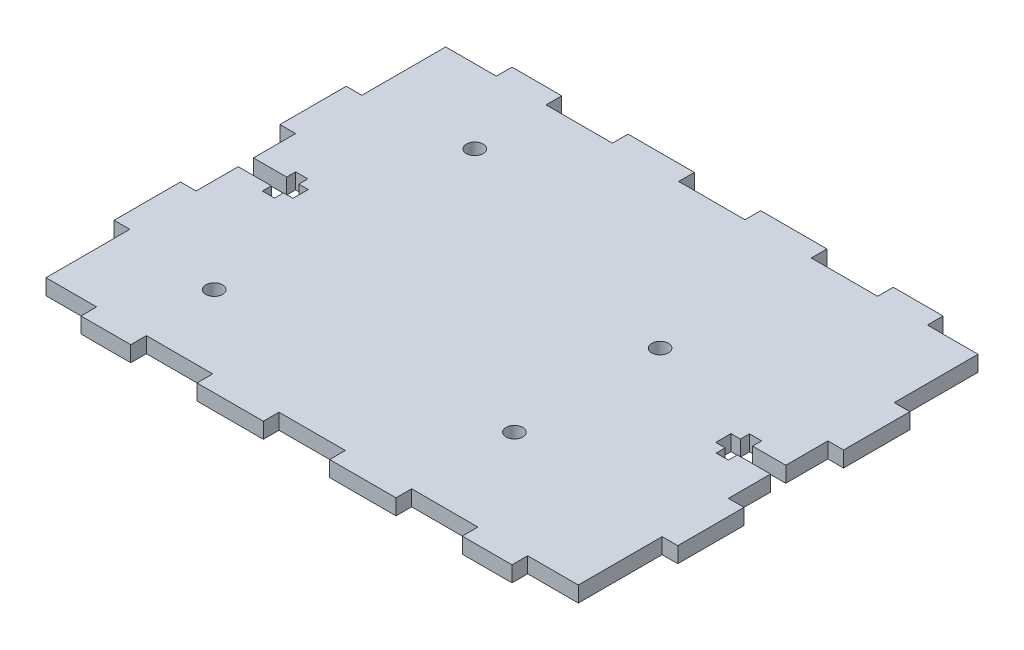
from build123d import *

# Parameters (mm, degrees)
SKETCH1_W           = 107.95
SKETCH1_H           = 82.55
BOSS_EXTRUDE1_DEPTH = 3
CUT_EXTRUDE2_REACH  = 137.929
SKETCH3_W           = 12.7
SKETCH3_H           = 3
SKETCH3_W_2         = 3
SKETCH3_H_2         = 19.05
CUT_EXTRUDE3_REACH  = 137.929
SKETCH4_R           = 1.6
CUT_EXTRUDE5_REACH  = 137.929


with BuildPart() as part:
    # Sketch1 → Boss-Extrude1 (new body)
    with BuildSketch(Plane(origin=(0, 0, 0), x_dir=(1, 0, 0), z_dir=(0, 1, 0))):
        with Locations((53.975, 41.275)):
            Rectangle(SKETCH1_W, SKETCH1_H)
    extrude(amount=BOSS_EXTRUDE1_DEPTH)

    # Sketch3 → Cut-Extrude2 (cut, up to next)
    with BuildSketch(Plane(origin=(0, 3, 0), x_dir=(1, 0, 0), z_dir=(0, 1, 0)), mode=Mode.PRIVATE) as cut_extrude2_sk1:
        with Locations((28.575, 1.5)):
            Rectangle(SKETCH3_W, SKETCH3_H)
    cut_extrude2_tool1 = extrude(cut_extrude2_sk1.sketch, amount=-CUT_EXTRUDE2_REACH, mode=Mode.PRIVATE) & part.part
    # Sketch3 → Cut-Extrude2 (cut, up to next)
    with BuildSketch(Plane(origin=(0, 3, 0), x_dir=(1, 0, 0), z_dir=(0, 1, 0)), mode=Mode.PRIVATE) as cut_extrude2_sk2:
        with Locations((79.375, 1.5)):
            Rectangle(SKETCH3_W, SKETCH3_H)
    cut_extrude2_tool2 = extrude(cut_extrude2_sk2.sketch, amount=-CUT_EXTRUDE2_REACH, mode=Mode.PRIVATE) & part.part
    # Sketch3 → Cut-Extrude2 (cut, up to next)
    with BuildSketch(Plane(origin=(0, 3, 0), x_dir=(1, 0, 0), z_dir=(0, 1, 0)), mode=Mode.PRIVATE) as cut_extrude2_sk3:
        with Locations((79.375, 81.05)):
            Rectangle(SKETCH3_W, SKETCH3_H)
    cut_extrude2_tool3 = extrude(cut_extrude2_sk3.sketch, amount=-CUT_EXTRUDE2_REACH, mode=Mode.PRIVATE) & part.part
    # Sketch3 → Cut-Extrude2 (cut, up to next)
    with BuildSketch(Plane(origin=(0, 3, 0), x_dir=(1, 0, 0), z_dir=(0, 1, 0)), mode=Mode.PRIVATE) as cut_extrude2_sk4:
        with Locations((1.5, 41.275)):
            Rectangle(SKETCH3_W_2, SKETCH3_H_2)
    cut_extrude2_tool4 = extrude(cut_extrude2_sk4.sketch, amount=-CUT_EXTRUDE2_REACH, mode=Mode.PRIVATE) & part.part
    # Sketch3 → Cut-Extrude2 (cut, up to next)
    with BuildSketch(Plane(origin=(0, 3, 0), x_dir=(1, 0, 0), z_dir=(0, 1, 0)), mode=Mode.PRIVATE) as cut_extrude2_sk5:
        with Locations((28.575, 81.05)):
            Rectangle(SKETCH3_W, SKETCH3_H)
    cut_extrude2_tool5 = extrude(cut_extrude2_sk5.sketch, amount=-CUT_EXTRUDE2_REACH, mode=Mode.PRIVATE) & part.part
    # Sketch3 → Cut-Extrude2 (cut, up to next)
    with BuildSketch(Plane(origin=(0, 3, 0), x_dir=(1, 0, 0), z_dir=(0, 1, 0)), mode=Mode.PRIVATE) as cut_extrude2_sk6:
        Polygon((53.975, 3), (60.325, 3), (60.325, 0), (53.975, 0), (47.625, 0), (47.625, 3), align=None)
    cut_extrude2_tool6 = extrude(cut_extrude2_sk6.sketch, amount=-CUT_EXTRUDE2_REACH, mode=Mode.PRIVATE) & part.part
    # Sketch3 → Cut-Extrude2 (cut, up to next)
    with BuildSketch(Plane(origin=(0, 3, 0), x_dir=(1, 0, 0), z_dir=(0, 1, 0)), mode=Mode.PRIVATE) as cut_extrude2_sk7:
        Polygon((60.325, 82.55), (53.975, 82.55), (47.625, 82.55), (47.625, 79.55), (53.975, 79.55), (60.325, 79.55), align=None)
    cut_extrude2_tool7 = extrude(cut_extrude2_sk7.sketch, amount=-CUT_EXTRUDE2_REACH, mode=Mode.PRIVATE) & part.part
    # Sketch3 → Cut-Extrude2 (cut, up to next)
    with BuildSketch(Plane(origin=(0, 3, 0), x_dir=(1, 0, 0), z_dir=(0, 1, 0)), mode=Mode.PRIVATE) as cut_extrude2_sk8:
        Polygon((0, 19.05), (3, 19.05), (3, 3), (12.7, 3), (12.7, 0), (0, 0), (0, 3), align=None)
    cut_extrude2_tool8 = extrude(cut_extrude2_sk8.sketch, amount=-CUT_EXTRUDE2_REACH, mode=Mode.PRIVATE) & part.part
    # Sketch3 → Cut-Extrude2 (cut, up to next)
    with BuildSketch(Plane(origin=(0, 3, 0), x_dir=(1, 0, 0), z_dir=(0, 1, 0)), mode=Mode.PRIVATE) as cut_extrude2_sk9:
        Polygon((107.95, 0), (107.95, 3), (107.95, 19.05), (104.95, 19.05), (104.95, 3), (95.25, 3), (95.25, 0), align=None)
    cut_extrude2_tool9 = extrude(cut_extrude2_sk9.sketch, amount=-CUT_EXTRUDE2_REACH, mode=Mode.PRIVATE) & part.part
    # Sketch3 → Cut-Extrude2 (cut, up to next)
    with BuildSketch(Plane(origin=(0, 3, 0), x_dir=(1, 0, 0), z_dir=(0, 1, 0)), mode=Mode.PRIVATE) as cut_extrude2_sk10:
        Polygon((0, 79.55), (0, 63.5), (3, 63.5), (3, 79.55), (12.7, 79.55), (12.7, 82.55), (0, 82.55), align=None)
    cut_extrude2_tool10 = extrude(cut_extrude2_sk10.sketch, amount=-CUT_EXTRUDE2_REACH, mode=Mode.PRIVATE) & part.part
    # Sketch3 → Cut-Extrude2 (cut, up to next)
    with BuildSketch(Plane(origin=(0, 3, 0), x_dir=(1, 0, 0), z_dir=(0, 1, 0)), mode=Mode.PRIVATE) as cut_extrude2_sk11:
        with Locations((106.45, 41.275)):
            Rectangle(SKETCH3_W_2, SKETCH3_H_2)
    cut_extrude2_tool11 = extrude(cut_extrude2_sk11.sketch, amount=-CUT_EXTRUDE2_REACH, mode=Mode.PRIVATE) & part.part
    # Sketch3 → Cut-Extrude2 (cut, up to next)
    with BuildSketch(Plane(origin=(0, 3, 0), x_dir=(1, 0, 0), z_dir=(0, 1, 0)), mode=Mode.PRIVATE) as cut_extrude2_sk12:
        Polygon((107.95, 63.5), (104.95, 63.5), (104.95, 79.55), (95.25, 79.55), (95.25, 82.55), (107.95, 82.55), (107.95, 79.55), align=None)
    cut_extrude2_tool12 = extrude(cut_extrude2_sk12.sketch, amount=-CUT_EXTRUDE2_REACH, mode=Mode.PRIVATE) & part.part
    add(cut_extrude2_tool1.solids().sort_by_distance((28.575, 3, -1.5))[0], mode=Mode.SUBTRACT)
    add(cut_extrude2_tool2.solids().sort_by_distance((79.375, 3, -1.5))[0], mode=Mode.SUBTRACT)
    add(cut_extrude2_tool3.solids().sort_by_distance((79.375, 3, -81.05))[0], mode=Mode.SUBTRACT)
    add(cut_extrude2_tool4.solids().sort_by_distance((1.5, 3, -41.275))[0], mode=Mode.SUBTRACT)
    add(cut_extrude2_tool5.solids().sort_by_distance((28.575, 3, -81.05))[0], mode=Mode.SUBTRACT)
    add(cut_extrude2_tool6.solids().sort_by_distance((53.975, 3, -1.5))[0], mode=Mode.SUBTRACT)
    add(cut_extrude2_tool7.solids().sort_by_distance((53.975, 3, -81.05))[0], mode=Mode.SUBTRACT)
    add(cut_extrude2_tool8.solids().sort_by_distance((1.5, 3, -18.821047))[0], mode=Mode.SUBTRACT)
    add(cut_extrude2_tool9.solids().sort_by_distance((107.721047, 3, -1.5))[0], mode=Mode.SUBTRACT)
    add(cut_extrude2_tool10.solids().sort_by_distance((0.228953, 3, -71.525))[0], mode=Mode.SUBTRACT)
    add(cut_extrude2_tool11.solids().sort_by_distance((106.45, 3, -41.275))[0], mode=Mode.SUBTRACT)
    add(cut_extrude2_tool12.solids().sort_by_distance((106.45, 3, -63.728953))[0], mode=Mode.SUBTRACT)

    # Sketch4 → Cut-Extrude3 (cut, up to next)
    with BuildSketch(Plane(origin=(0, 3, 0), x_dir=(1, 0, 0), z_dir=(0, 1, 0)), mode=Mode.PRIVATE) as cut_extrude3_sk1:
        with Locations(Location((22.6875, 65.425, 0), (0, 0, 270))):
            Circle(SKETCH4_R)
    cut_extrude3_tool1 = extrude(cut_extrude3_sk1.sketch, amount=-CUT_EXTRUDE3_REACH, mode=Mode.PRIVATE) & part.part
    # Sketch4 → Cut-Extrude3 (cut, up to next)
    with BuildSketch(Plane(origin=(0, 3, 0), x_dir=(1, 0, 0), z_dir=(0, 1, 0)), mode=Mode.PRIVATE) as cut_extrude3_sk2:
        with Locations(Location((21.0875, 17.125, 0), (0, 0, 270))):
            Circle(SKETCH4_R)
    cut_extrude3_tool2 = extrude(cut_extrude3_sk2.sketch, amount=-CUT_EXTRUDE3_REACH, mode=Mode.PRIVATE) & part.part
    # Sketch4 → Cut-Extrude3 (cut, up to next)
    with BuildSketch(Plane(origin=(0, 3, 0), x_dir=(1, 0, 0), z_dir=(0, 1, 0)), mode=Mode.PRIVATE) as cut_extrude3_sk3:
        with Locations(Location((73.4875, 22.225, 0), (0, 0, 270))):
            Circle(SKETCH4_R)
    cut_extrude3_tool3 = extrude(cut_extrude3_sk3.sketch, amount=-CUT_EXTRUDE3_REACH, mode=Mode.PRIVATE) & part.part
    # Sketch4 → Cut-Extrude3 (cut, up to next)
    with BuildSketch(Plane(origin=(0, 3, 0), x_dir=(1, 0, 0), z_dir=(0, 1, 0)), mode=Mode.PRIVATE) as cut_extrude3_sk4:
        with Locations(Location((73.4875, 50.125, 0), (0, 0, 270))):
            Circle(SKETCH4_R)
    cut_extrude3_tool4 = extrude(cut_extrude3_sk4.sketch, amount=-CUT_EXTRUDE3_REACH, mode=Mode.PRIVATE) & part.part
    add(cut_extrude3_tool1.solids().sort_by_distance((22.6875, 3, -65.425))[0], mode=Mode.SUBTRACT)
    add(cut_extrude3_tool2.solids().sort_by_distance((21.0875, 3, -17.125))[0], mode=Mode.SUBTRACT)
    add(cut_extrude3_tool3.solids().sort_by_distance((73.4875, 3, -22.225))[0], mode=Mode.SUBTRACT)
    add(cut_extrude3_tool4.solids().sort_by_distance((73.4875, 3, -50.125))[0], mode=Mode.SUBTRACT)

    # Sketch6 → Cut-Extrude5 (cut, up to next)
    with BuildSketch(Plane(origin=(0, 3, 0), x_dir=(1, 0, 0), z_dir=(0, 1, 0)), mode=Mode.PRIVATE) as cut_extrude5_sk1:
        Polygon((3, 39.8145), (9.35, 39.8145), (9.35, 38.0873), (11.6868, 38.0873), (11.6868, 39.8145), (13.49375, 39.8145), (13.49375, 41.275), (13.49375, 42.7355), (11.6868, 42.7355), (11.6868, 44.4627), (9.35, 44.4627), (9.35, 42.7355), (3, 42.7355), (3, 41.275), align=None)
    cut_extrude5_tool1 = extrude(cut_extrude5_sk1.sketch, amount=-CUT_EXTRUDE5_REACH, mode=Mode.PRIVATE) & part.part
    # Sketch6 → Cut-Extrude5 (cut, up to next)
    with BuildSketch(Plane(origin=(0, 3, 0), x_dir=(1, 0, 0), z_dir=(0, 1, 0)), mode=Mode.PRIVATE) as cut_extrude5_sk2:
        Polygon((94.45625, 42.7355), (94.45625, 41.275), (94.45625, 39.8145), (96.2632, 39.8145), (96.2632, 38.0873), (98.6, 38.0873), (98.6, 39.8145), (104.95, 39.8145), (104.95, 41.275), (104.95, 42.7355), (98.6, 42.7355), (98.6, 44.4627), (96.2632, 44.4627), (96.2632, 42.7355), align=None)
    cut_extrude5_tool2 = extrude(cut_extrude5_sk2.sketch, amount=-CUT_EXTRUDE5_REACH, mode=Mode.PRIVATE) & part.part
    add(cut_extrude5_tool1.solids().sort_by_distance((8.720382, 3, -41.275))[0], mode=Mode.SUBTRACT)
    add(cut_extrude5_tool2.solids().sort_by_distance((99.229618, 3, -41.275))[0], mode=Mode.SUBTRACT)


solid = part.part
